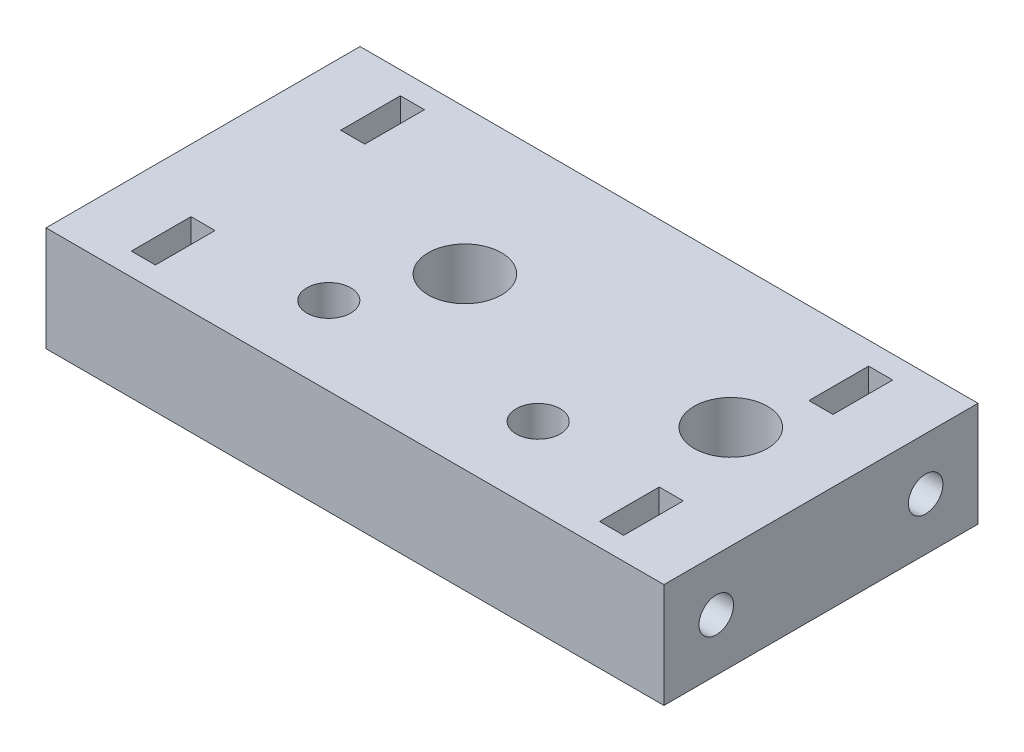
from build123d import *

# Parameters (mm, degrees)
SKETCH1_W           = 59.0272
SKETCH1_H           = 30
BOSS_EXTRUDE1_DEPTH = 10
SKETCH2_R           = 2.1
CUT_EXTRUDE1_DEPTH  = 35.58399319
SKETCH3_R           = 1.65
CUT_EXTRUDE2_DEPTH  = 12
CUT_EXTRUDE3_START  = -12
SKETCH4_R           = 1.65
CUT_EXTRUDE3_DEPTH  = 12
CUT_EXTRUDE4_DEPTH  = 2.3
CUT_EXTRUDE5_DEPTH  = 2.3
SKETCH7_R           = 3.5
CUT_EXTRUDE6_DEPTH  = 35.58399319


with BuildPart() as part:
    # Sketch1 → Boss-Extrude1 (new body)
    with BuildSketch(Plane(origin=(0, 0, 0), x_dir=(1, 0, 0), z_dir=(0, 1, 0))):
        Rectangle(SKETCH1_W, SKETCH1_H)
    extrude(amount=BOSS_EXTRUDE1_DEPTH)

    # Sketch2 → Cut-Extrude1 (cut, through all)
    with BuildSketch(Plane(origin=(0, 10, 0), x_dir=(1, 0, 0), z_dir=(0, 1, 0))):
        with Locations(Location((-10, -7.5, 0), (0, 0, 270))):
            Circle(SKETCH2_R)
        with Locations(Location((10, -7.5, 0), (0, 0, 270))):
            Circle(SKETCH2_R)
    extrude(amount=-CUT_EXTRUDE1_DEPTH, mode=Mode.SUBTRACT)

    # Sketch3 → Cut-Extrude2 (cut)
    with BuildSketch(Plane(origin=(29.5136, 0, 0), x_dir=(0, 0, -1), z_dir=(1, 0, 0))):
        with Locations((-10, 5)):
            Circle(SKETCH3_R)
        with Locations((10, 5)):
            Circle(SKETCH3_R)
    extrude(amount=-CUT_EXTRUDE2_DEPTH, mode=Mode.SUBTRACT)

    # Sketch4 → Cut-Extrude3 (cut)
    with BuildSketch(Plane.ZY.offset(29.5136).offset(CUT_EXTRUDE3_START)):
        with Locations(Location((-10, 5, 0), (0, 0, 180))):
            Circle(SKETCH4_R)
        with Locations(Location((10, 5, 0), (0, 0, 180))):
            Circle(SKETCH4_R)
    extrude(amount=CUT_EXTRUDE3_DEPTH, mode=Mode.SUBTRACT)

    # Sketch5 → Cut-Extrude4 (cut)
    with BuildSketch(Plane(origin=(23.5136, 0, 0), x_dir=(0, 0, -1), z_dir=(1, 0, 0))):
        Polygon((-12.85, 6.645448267), (-12.85, 10), (-7.15, 10), (-7.15, 6.645448267), (-7.15, 3.354551733), (-10, 1.709103466), (-12.85, 3.354551733), align=None)
        Polygon((7.15, 6.645448267), (7.15, 3.354551733), (10, 1.709103466), (12.85, 3.354551733), (12.85, 6.645448267), (12.85, 10), (7.15, 10), align=None)
    extrude(amount=-CUT_EXTRUDE4_DEPTH, mode=Mode.SUBTRACT)

    # Sketch6 → Cut-Extrude5 (cut)
    with BuildSketch(Plane.ZY.offset(23.5136)):
        Polygon((-12.85, 6.645448267), (-12.85, 10), (-7.15, 10), (-7.15, 6.645448267), (-7.15, 3.354551733), (-10, 1.709103466), (-12.85, 3.354551733), align=None)
        Polygon((7.15, 6.645448267), (7.15, 3.354551733), (10, 1.709103466), (12.85, 3.354551733), (12.85, 6.645448267), (12.85, 10), (7.15, 10), align=None)
    extrude(amount=-CUT_EXTRUDE5_DEPTH, mode=Mode.SUBTRACT)

    # Sketch7 → Cut-Extrude6 (cut, through all)
    with BuildSketch(Plane(origin=(0, 10, 0), x_dir=(1, 0, 0), z_dir=(0, 1, 0))):
        with Locations(Location((19.7, 1.2, 0), (0, 0, 270))):
            Circle(SKETCH7_R)
        with Locations(Location((-5.7, 1.2, 0), (0, 0, 270))):
            Circle(SKETCH7_R)
    extrude(amount=-CUT_EXTRUDE6_DEPTH, mode=Mode.SUBTRACT)


solid = part.part
